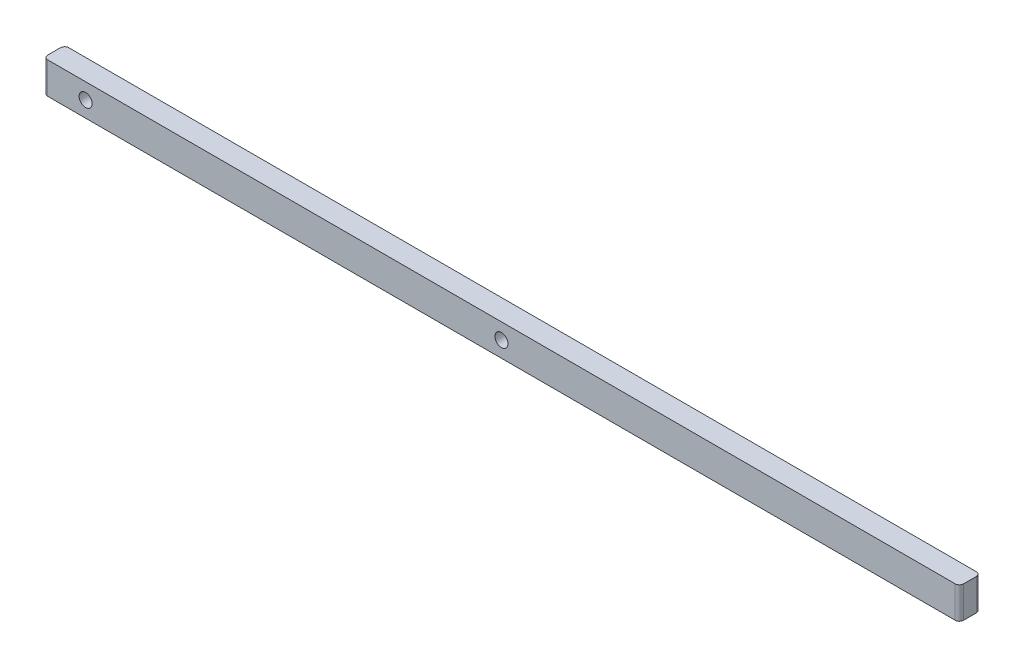
from build123d import *

# Parameters (mm, degrees)
SKETCH1_W               = 552.45
SKETCH1_H               = 19.05
BOSS_EXTRUDE1_DEPTH     = 6.35
CUT_EXTRUDE1_DEPTH      = 277.680802099
CUT_EXTRUDE1_DEPTH_BACK = 277.680802099
SKETCH2_R               = 3.937
FILLET1_R               = 2.54


with BuildPart() as part:
    # Sketch1 → Boss-Extrude1 (new, symmetric)
    with BuildSketch(Plane.XY):
        Rectangle(SKETCH1_W, SKETCH1_H)
    extrude(amount=BOSS_EXTRUDE1_DEPTH, both=True)

    # Sketch2 → Cut-Extrude1 (cut, two sides: drawn at the far end of the back side and taken through both)
    with BuildSketch(Plane.XY.offset(6.35).offset(-CUT_EXTRUDE1_DEPTH_BACK)):
        Circle(SKETCH2_R)
        with Locations((-250.825, 0)):
            Circle(SKETCH2_R)
    extrude(amount=CUT_EXTRUDE1_DEPTH + CUT_EXTRUDE1_DEPTH_BACK, mode=Mode.SUBTRACT)

    # Fillet1
    fillet1_edges = [part.edges().sort_by_distance(p)[0] for p in [
        (-276.225, 0, 6.35),
        (276.225, 0, 6.35),
        (-276.225, 0, -6.35),
        (276.225, 0, -6.35),
    ]]
    fillet(fillet1_edges, radius=FILLET1_R)


solid = part.part
